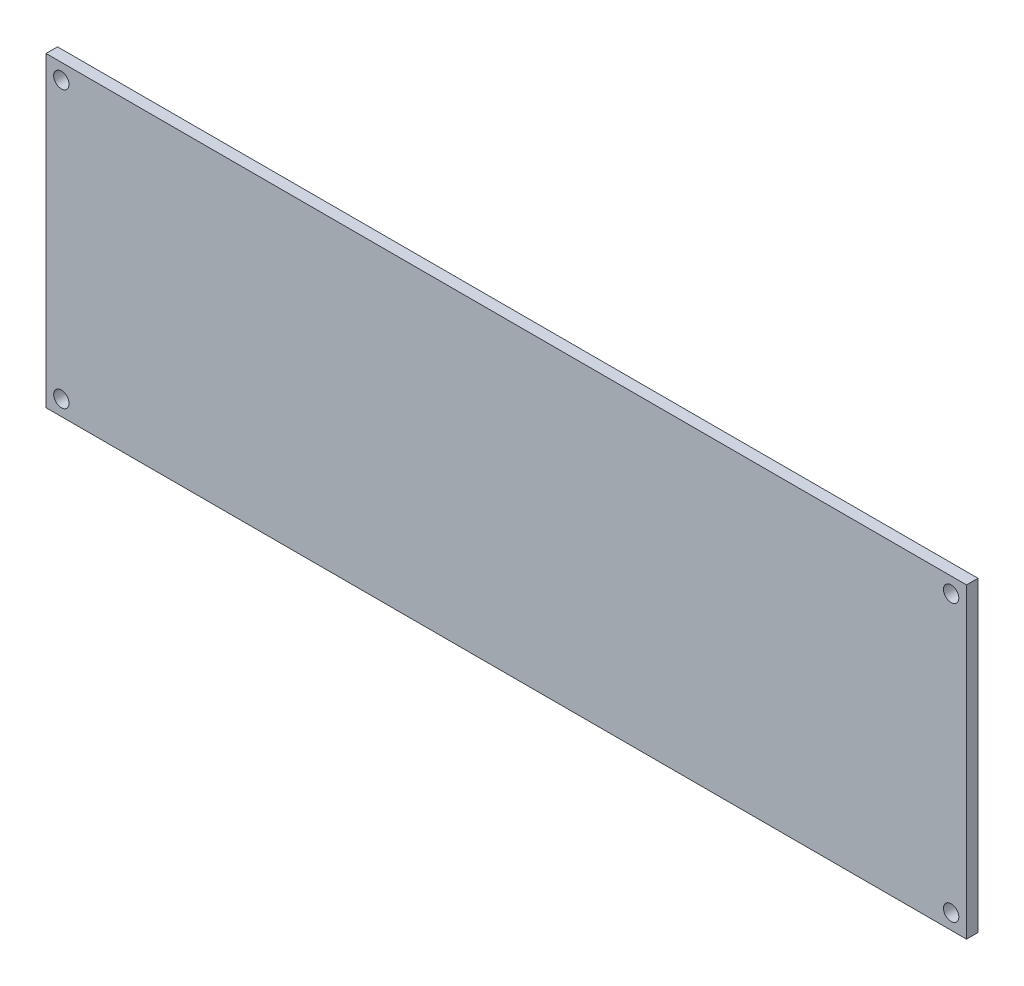
from build123d import *

# Parameters (mm, degrees)
SKETCH_1_W      = 120
SKETCH_1_H      = 40
SKETCH_1_R      = 1
EXTRUDE_1_DEPTH = 1.5


with BuildPart() as part:
    # Эскиз1 → Бобышка-Вытянуть1 (new body)
    with BuildSketch(Plane.XY):
        with Locations((60, 20)):
            Rectangle(SKETCH_1_W, SKETCH_1_H)
        with Locations((2, 38)):
            Circle(SKETCH_1_R, mode=Mode.SUBTRACT)
        with Locations(Location((118, 38, 0), (0, 0, 180))):
            Circle(SKETCH_1_R, mode=Mode.SUBTRACT)
        with Locations((118, 2)):
            Circle(SKETCH_1_R, mode=Mode.SUBTRACT)
        with Locations(Location((2, 2, 0), (0, 0, 180))):
            Circle(SKETCH_1_R, mode=Mode.SUBTRACT)
    extrude(amount=EXTRUDE_1_DEPTH)


solid = part.part
